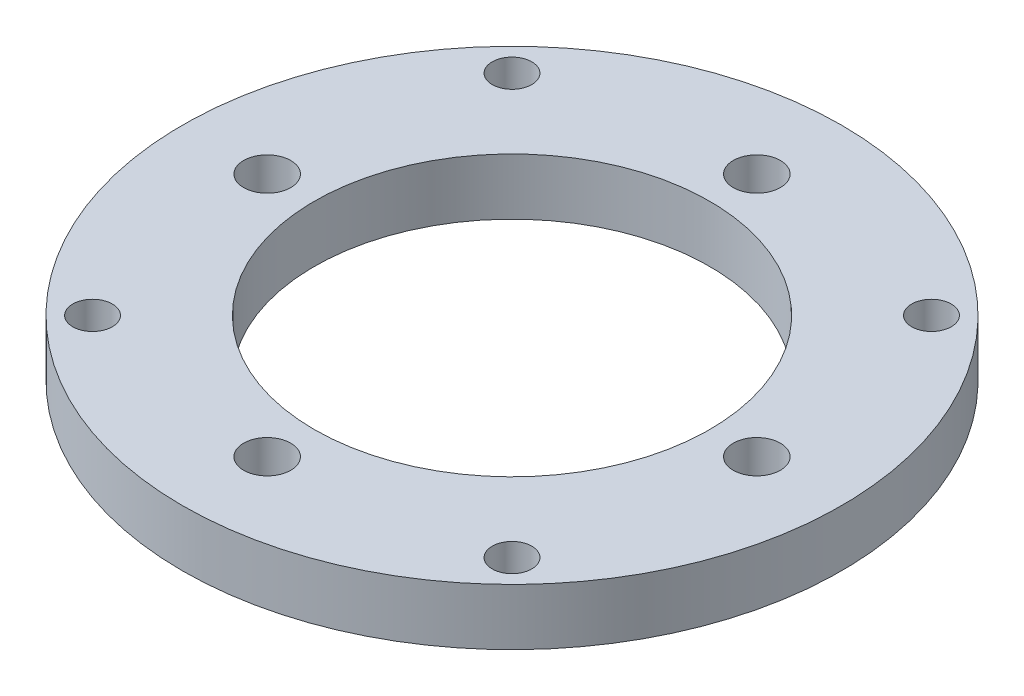
from build123d import *

# Parameters (mm, degrees)
SKETCH_1_R          = 35
EXTRUDE_1_DEPTH     = 6
SKETCH_2_R          = 21
SKETCH_2_R_2        = 2.5
SKETCH_2_R_3        = 2.1
CUT_EXTRUDE_1_DEPTH = 10
CHAMFER_1_SIZE      = 2


with BuildPart() as part:
    # Эскиз1 → Бобышка-Вытянуть1 (new body)
    with BuildSketch(Plane(origin=(0, 0, 0), x_dir=(1, 0, 0), z_dir=(0, 1, 0))):
        with Locations(Location((0, 0, 0), (0, 0, 270))):
            Circle(SKETCH_1_R)
    extrude(amount=EXTRUDE_1_DEPTH)

    # Эскиз2 → Вырез-Вытянуть1 (cut)
    with BuildSketch(Plane(origin=(0, 6, 0), x_dir=(1, 0, 0), z_dir=(0, 1, 0))):
        with Locations(Location((0, 0, 0), (0, 0, 270))):
            Circle(SKETCH_2_R)
        with Locations(Location((0, 26, 0), (0, 0, 270))):
            Circle(SKETCH_2_R_2)
        with Locations(Location((0, -26, 0), (0, 0, 270))):
            Circle(SKETCH_2_R_2)
        with Locations(Location((26, 0, 0), (0, 0, 270))):
            Circle(SKETCH_2_R_2)
        with Locations(Location((-26, 0, 0), (0, 0, 270))):
            Circle(SKETCH_2_R_2)
        with Locations(Location((-22.273863607, 22.273863607, 0), (0, 0, 270))):
            Circle(SKETCH_2_R_3)
        with Locations(Location((-22.273863607, -22.273863607, 0), (0, 0, 270))):
            Circle(SKETCH_2_R_3)
        with Locations(Location((22.273863607, -22.273863607, 0), (0, 0, 270))):
            Circle(SKETCH_2_R_3)
        with Locations(Location((22.273863607, 22.273863607, 0), (0, 0, 270))):
            Circle(SKETCH_2_R_3)
    extrude(amount=-CUT_EXTRUDE_1_DEPTH, mode=Mode.SUBTRACT)

    # Фаска1
    chamfer_1_edges = [part.edges().sort_by_distance(p)[0] for p in [
        (0, 0, -28.5),
        (0, 0, 23.5),
        (26, 0, -2.5),
        (-26, 0, -2.5),
    ]]
    chamfer(chamfer_1_edges, length=CHAMFER_1_SIZE)


solid = part.part
